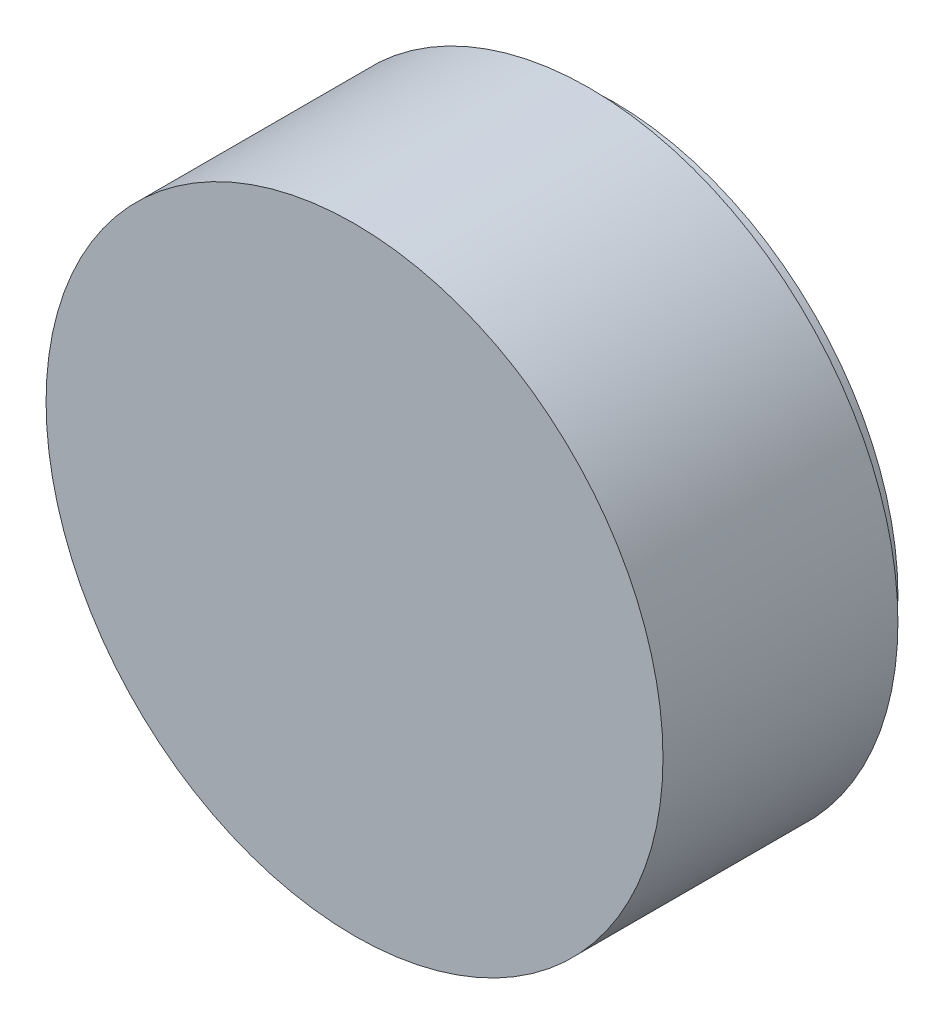
from build123d import *

# Parameters (mm, degrees)
SKETCH1_R           = 24.257
BOSS_EXTRUDE1_DEPTH = 2
SKETCH2_R           = 26.257
BOSS_EXTRUDE2_DEPTH = 20


with BuildPart() as part:
    # Sketch1 → Boss-Extrude1 (new body)
    with BuildSketch(Plane.XY):
        Circle(SKETCH1_R)
    extrude(amount=BOSS_EXTRUDE1_DEPTH)

    # Sketch2 → Boss-Extrude2 (add)
    with BuildSketch(Plane.XY.offset(2)):
        Circle(SKETCH2_R)
    extrude(amount=BOSS_EXTRUDE2_DEPTH)


solid = part.part
